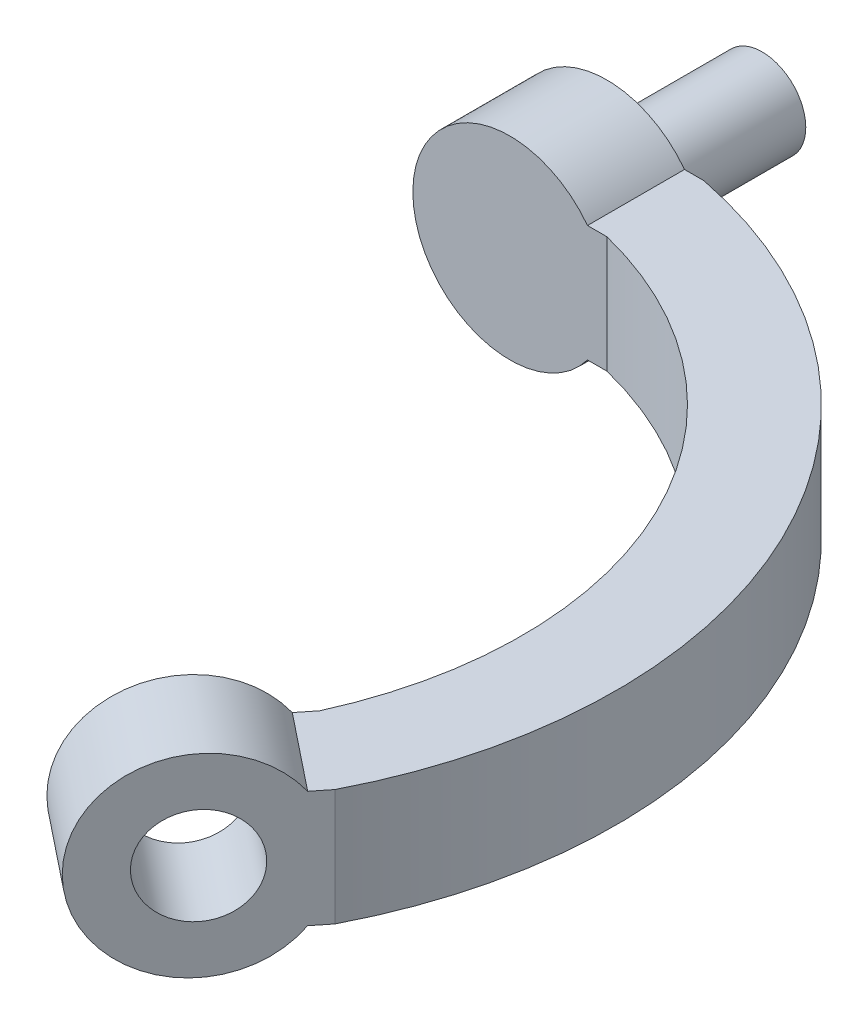
from build123d import *

# Parameters (mm, degrees)
SKETCH_2_R           = 5
EXTRUDE_3_DEPTH      = 5
EXTRUDE_4_DEPTH      = 3
EXTRUDE_4_DEPTH_BACK = 3
SKETCH_4_W           = 5
SKETCH_4_H           = 6
EXTRUDE_5_DEPTH      = 3
SKETCH_5_W           = 5
SKETCH_5_H           = 6
EXTRUDE_6_DEPTH      = 3
SKETCH_6_R           = 2.5
CUT_EXTRUDE_1_DEPTH  = 5
EXTRUDE_START        = -5
SKETCH_7_R           = 2.25
EXTRUDE_7_DEPTH      = 8


with BuildPart() as part:
    # 草图2 → 凸台-拉伸3 (new body)
    with BuildSketch(Plane.XY):
        Circle(SKETCH_2_R)
    extrude(amount=EXTRUDE_3_DEPTH)



with BuildPart() as body_2:
    # 草图3 → 凸台-拉伸4 (new, two sides: drawn at the far end of the back side and taken through both)
    with BuildSketch(Plane(origin=(0, 0, 0), x_dir=(1, 0, 0), z_dir=(0, 1, 0)).offset(-EXTRUDE_4_DEPTH_BACK)):
        with BuildLine():
            ThreePointArc((5, 0), (22.970151286, -13.937805377), (22.663527237, -36.677522562))
            Line((22.663527237, -36.677522562), (18.754292098, -33.560171022))
            ThreePointArc((18.754292098, -33.560171022), (18.573837526, -16.055026018), (5, -5))
            Line((5, -5), (5, 0))
        make_face()
    extrude(amount=EXTRUDE_4_DEPTH + EXTRUDE_4_DEPTH_BACK)



with BuildPart() as body_3:
    # 草图3<3> → 旋转1 (revolve)
    with BuildSketch(Plane(origin=(0, 0, 0), x_dir=(1, 0, 0), z_dir=(0, 1, 0)), mode=Mode.PRIVATE) as revolve_1_sk:
        Polygon((22.663527237, -36.677522562), (18.754292098, -33.560171022), (15.636940557, -37.469406161), (19.546175697, -40.586757701), align=None)
    revolve(revolve_1_sk.sketch.rotate(Axis((0, 0, 25), (0.7818470278677169, 0, 0.6234703080455537)), 180), axis=Axis((0, 0, 25), (0.7818470278677169, 0, 0.6234703080455537)))


with BuildPart() as body_2_1:
    add(body_2.part)

    add(body_3.part)  # 凸台-拉伸5 merges body 3
    # 草图4 → 凸台-拉伸5 (add)
    with BuildSketch(Plane(origin=(-9.069108643, 0, 11.372884235), x_dir=(0.7818470278677175, 0, 0.6234703080455529), z_dir=(-0.6234703080455529, 0, 0.7818470278677175))):
        with Locations((38.086757701, 0)):
            Rectangle(SKETCH_4_W, SKETCH_4_H)
    extrude(amount=EXTRUDE_5_DEPTH)


with BuildPart() as part_1:
    add(part.part)

    add(body_2_1.part)  # 凸台-拉伸6 merges body 2
    # 草图5 → 凸台-拉伸6 (add)
    with BuildSketch(Plane.ZY.offset(-5)):
        with Locations((2.5, 0)):
            Rectangle(SKETCH_5_W, SKETCH_5_H)
    extrude(amount=EXTRUDE_6_DEPTH)

    # 草图6 → 切除-拉伸1 (cut)
    with BuildSketch(Plane(origin=(27.82340074, 0, 22.187286786), x_dir=(-0.6234703080455528, 0, 0.7818470278677175), z_dir=(-0.7818470278677175, 0, -0.6234703080455528))):
        with Locations((19.546175697, 0)):
            Circle(SKETCH_6_R)
    extrude(amount=-CUT_EXTRUDE_1_DEPTH, mode=Mode.SUBTRACT)

    # 草图7 → 凸台-拉伸7 (add)
    with BuildSketch(Plane.XY.offset(5).offset(EXTRUDE_START)):
        Circle(SKETCH_7_R)
    extrude(amount=-EXTRUDE_7_DEPTH)


solid = part_1.part
